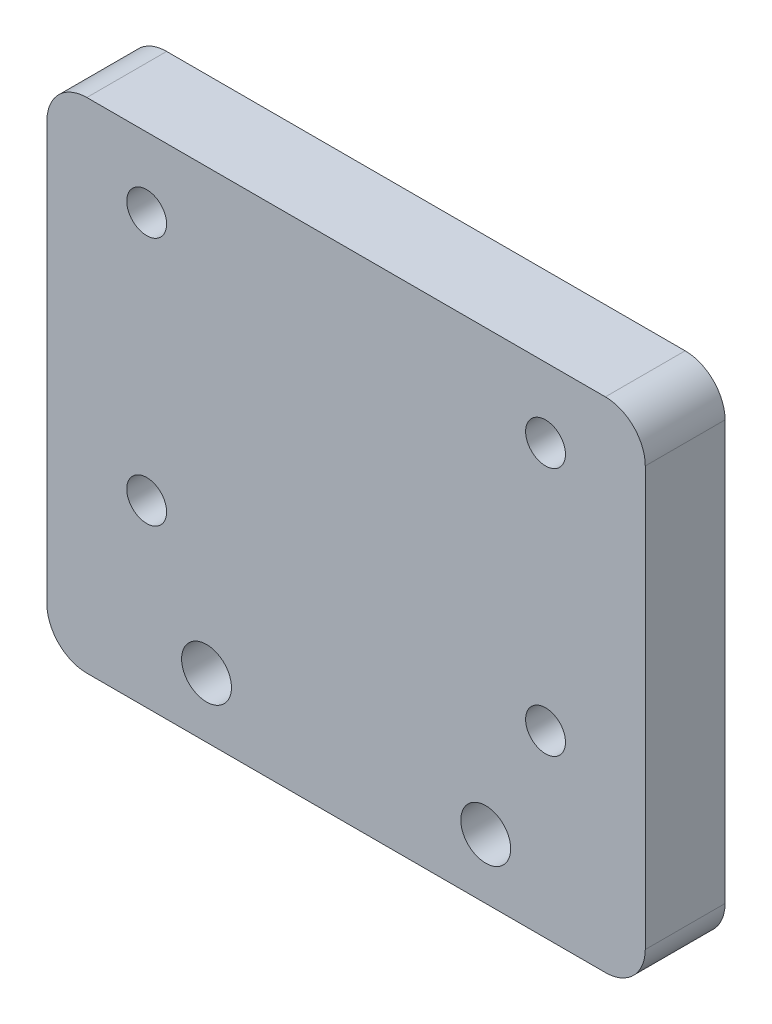
from build123d import *

# Parameters (mm, degrees)
SKETCH_1_W      = 30
SKETCH_1_H      = 25
SKETCH_1_R      = 1.25
SKETCH_1_R_2    = 1
EXTRUDE_1_DEPTH = 4
FILLET_1_R      = 2


with BuildPart() as part:
    # ｽｹｯﾁ1 → ﾎﾞｽ - 押し出し1 (new body)
    with BuildSketch(Plane.XY):
        Rectangle(SKETCH_1_W, SKETCH_1_H)
        with Locations((-7, -9.5)):
            Circle(SKETCH_1_R, mode=Mode.SUBTRACT)
        with Locations((7, -9.5)):
            Circle(SKETCH_1_R, mode=Mode.SUBTRACT)
        with Locations((-10, -3.5)):
            Circle(SKETCH_1_R_2, mode=Mode.SUBTRACT)
        with Locations((-10, 9)):
            Circle(SKETCH_1_R_2, mode=Mode.SUBTRACT)
        with Locations((10, 9)):
            Circle(SKETCH_1_R_2, mode=Mode.SUBTRACT)
        with Locations((10, -3.5)):
            Circle(SKETCH_1_R_2, mode=Mode.SUBTRACT)
    extrude(amount=EXTRUDE_1_DEPTH)

    # ﾌｨﾚｯﾄ1
    fillet_1_edges = [part.edges().sort_by_distance(p)[0] for p in [
        (15, -12.5, 2),
        (-15, -12.5, 2),
        (-15, 12.5, 2),
        (15, 12.5, 2),
    ]]
    fillet(fillet_1_edges, radius=FILLET_1_R)


solid = part.part
